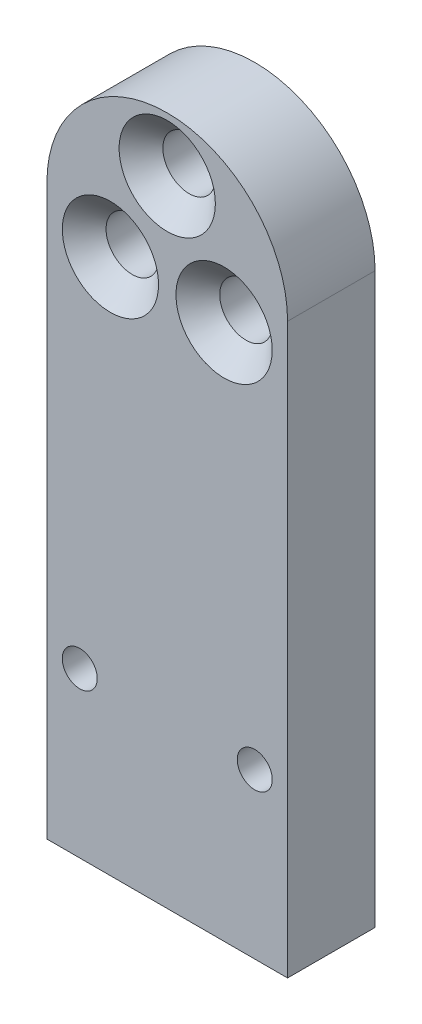
from build123d import *

# Parameters (mm, degrees)
RESSALTO_EXTRUS_O1_DEPTH                             = 4
FURO_ROSCADO_DE_M21_D                                = 1.6
ESCAREADO_PARA_PARAFUSO_COM_CABE_A_ESCAR_D           = 2.4
ESCAREADO_PARA_PARAFUSO_COM_CABE_A_ESCAR_CSINK_D     = 4.4
ESCAREADO_PARA_PARAFUSO_COM_CABE_A_ESCAR_CSINK_ANGLE = 90
PADR_OCIRCULAR1_COUNT                                = 3


with BuildPart() as part:
    # Esboço1 → Ressalto-extrusão1 (new body)
    with BuildSketch(Plane.XY):
        with BuildLine():
            Line((-5.5, 0), (-5.5, -26))
            Line((-5.5, -26), (5.5, -26))
            Line((5.5, -26), (5.5, 0))
            ThreePointArc((5.5, 0), (0, 5.5), (-5.5, 0))
        make_face()
    extrude(amount=RESSALTO_EXTRUS_O1_DEPTH)

    # Furo roscado de M21 (through all)
    with Locations(Plane(origin=(-4, -18.5, 4), x_dir=(1, 0, 0), z_dir=(0, 0, 1))):
        with Locations((0, 0), (8, 0)):
            Hole(FURO_ROSCADO_DE_M21_D / 2)

    # Escareado para parafuso com cabeça escareada chata de M21 (through all)
    with Locations(Plane(origin=(0, 3, 4), x_dir=(1, 0, 0), z_dir=(0, 0, 1))):
        with Locations((0, 0)):
            escareado_para_parafuso_com_cabe_a_escar = CounterSinkHole(ESCAREADO_PARA_PARAFUSO_COM_CABE_A_ESCAR_D / 2, ESCAREADO_PARA_PARAFUSO_COM_CABE_A_ESCAR_CSINK_D / 2, counter_sink_angle=ESCAREADO_PARA_PARAFUSO_COM_CABE_A_ESCAR_CSINK_ANGLE)

    # PadrãoCircular1: Escareado para parafuso com cabeça escareada chata de M21 ×3 about axis
    padr_ocircular1_axis = Axis((0, 0, 0), (0, 0, 1))
    for i in range(1, PADR_OCIRCULAR1_COUNT):
        add(escareado_para_parafuso_com_cabe_a_escar.rotate(padr_ocircular1_axis, i * 360 / PADR_OCIRCULAR1_COUNT), mode=Mode.SUBTRACT)


solid = part.part
